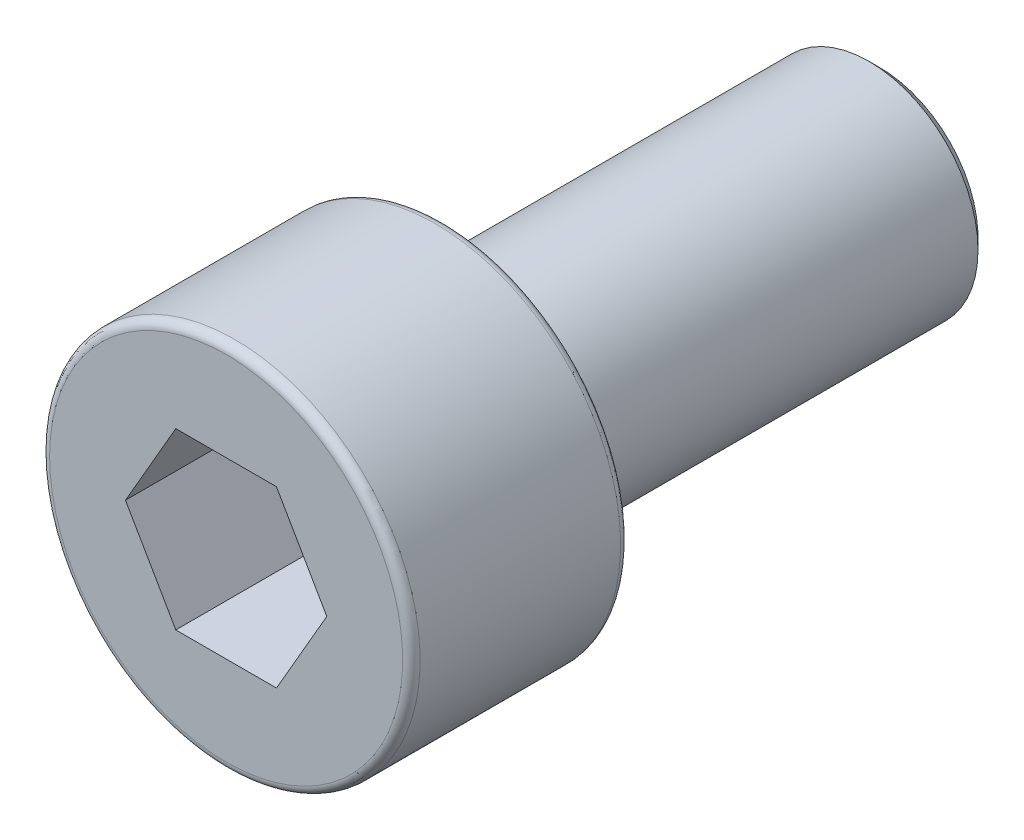
from build123d import *

# Parameters (mm, degrees)
SKETCH1_R           = 4.25
BOSS_EXTRUDE1_DEPTH = 5
SKETCH2_R           = 2.5
BOSS_EXTRUDE2_DEPTH = 10
CUT_EXTRUDE1_DEPTH  = 4
CHAMFER1_SIZE       = 0.25
FILLET1_R           = 0.2


with BuildPart() as part:
    # Sketch1 → Boss-Extrude1 (new body)
    with BuildSketch(Plane.XY.offset(15)):
        with Locations(Location((0, 0, 0), (0, 0, 180))):
            Circle(SKETCH1_R)
    extrude(amount=-BOSS_EXTRUDE1_DEPTH)

    # Sketch2 → Boss-Extrude2 (add)
    with BuildSketch(Plane(origin=(0, 0, 10), x_dir=(-1, 0, 0), z_dir=(0, 0, -1))):
        Circle(SKETCH2_R)
    extrude(amount=BOSS_EXTRUDE2_DEPTH)

    # Sketch3 → Cut-Extrude1 (cut)
    with BuildSketch(Plane.XY.offset(15)):
        Polygon((-2.309401077, 0), (-1.154700538, -2), (1.154700538, -2), (2.309401077, 0), (1.154700538, 2), (-1.154700538, 2), align=None)
    extrude(amount=-CUT_EXTRUDE1_DEPTH, mode=Mode.SUBTRACT)

    # Chamfer1
    chamfer1_edges = [part.edges().sort_by_distance(p)[0] for p in [
        (2.5, 0, 0),
    ]]
    chamfer(chamfer1_edges, length=CHAMFER1_SIZE)

    # Fillet1
    fillet1_edges = [part.edges().sort_by_distance(p)[0] for p in [
        (4.25, 0, 15),
        (4.25, 0, 10),
    ]]
    fillet(fillet1_edges, radius=FILLET1_R)


solid = part.part
